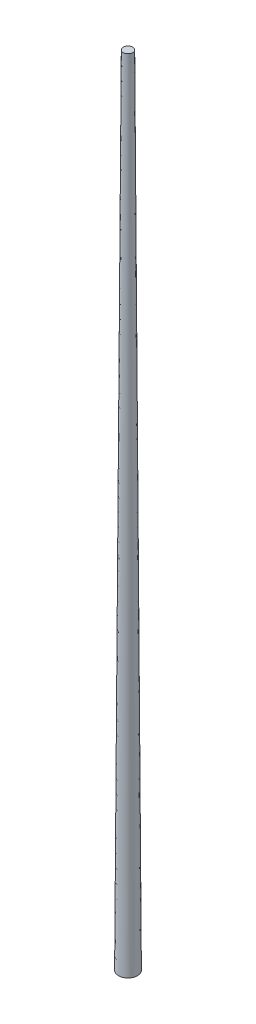
from build123d import *


with BuildPart() as part:
    # Esquisse1 → Révolution1 (revolve)
    with BuildSketch(Plane.XY, mode=Mode.PRIVATE) as r_volution1_sk:
        Polygon((0, 0), (10, 0), (5, 840), (0, 840), align=None)
    revolve(r_volution1_sk.sketch.rotate(Axis((0, 840, 0), (0, -1, 0)), 90), axis=Axis((0, 840, 0), (0, -1, 0)))


solid = part.part
